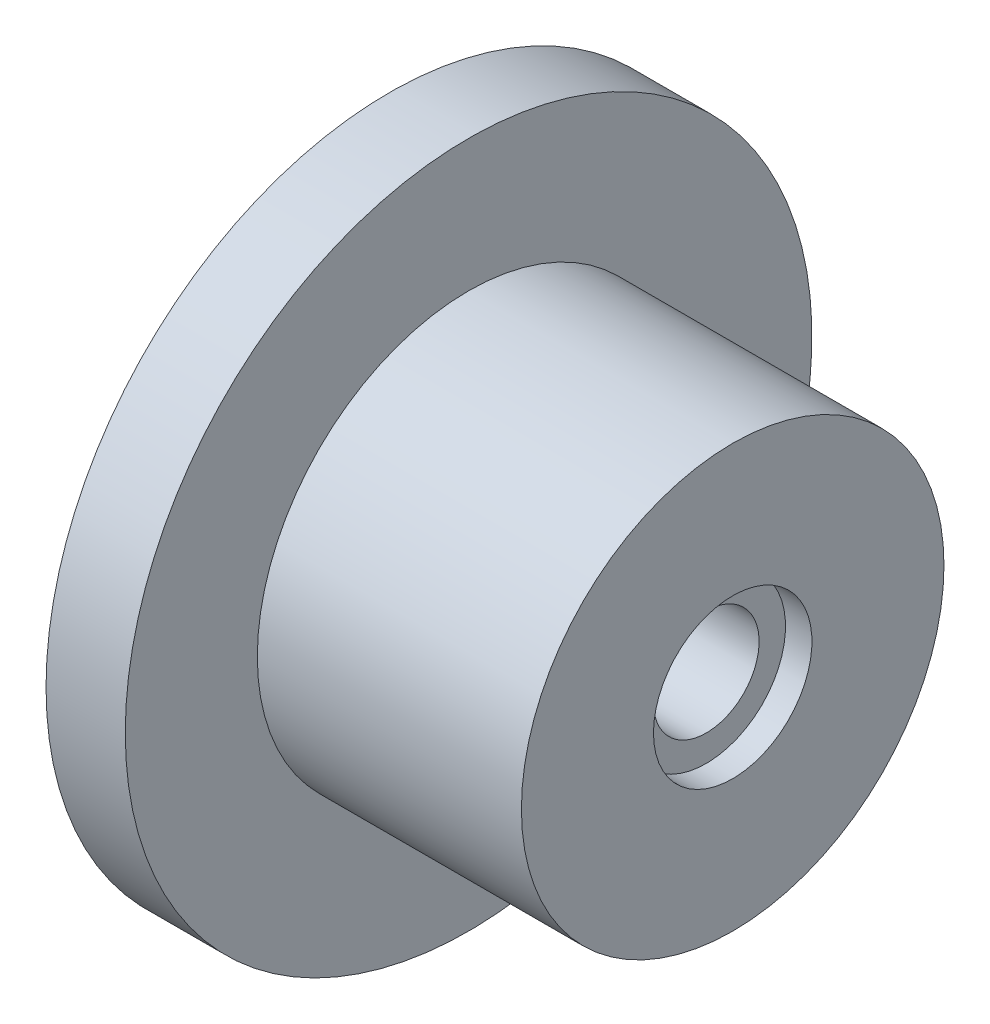
from build123d import *


with BuildPart() as part:
    # Sketch1 → Revolve1 (revolve)
    with BuildSketch(Plane.XY, mode=Mode.PRIVATE) as revolve1_sk:
        Polygon((0, 4), (0, 2), (8, 2), (8, 3), (9, 3), (9, 8), (-1, 8), (-1, 13), (-4, 13), (-4, 4), align=None)
    revolve(revolve1_sk.sketch.rotate(Axis((0, 0, 0), (1, 0, 0)), 90), axis=Axis((0, 0, 0), (1, 0, 0)))


solid = part.part
